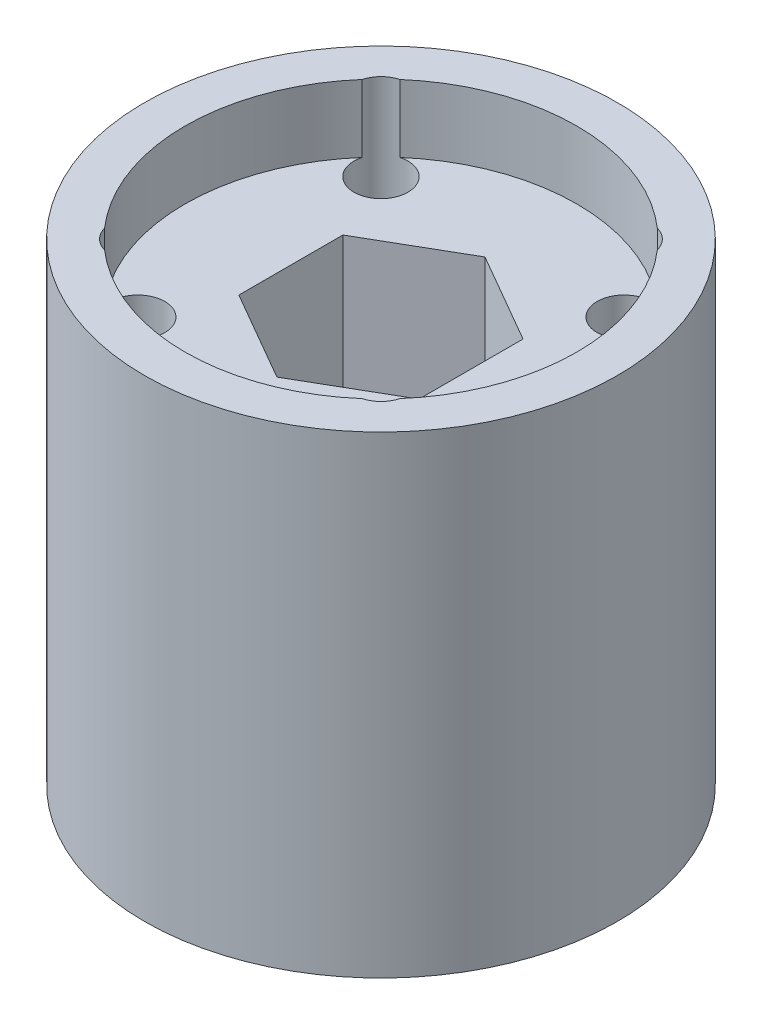
from build123d import *

# Parameters (mm, degrees)
SKETCH1_R           = 17.5
BOSS_EXTRUDE1_DEPTH = 35
CUT_EXTRUDE1_DEPTH  = 15
SKETCH3_R           = 4.1
CUT_EXTRUDE2_DEPTH  = 32.819805153
SKETCH4_R           = 2
CUT_EXTRUDE3_DEPTH  = 43.866070499
SKETCH5_R           = 14.5
CUT_EXTRUDE4_DEPTH  = 5


with BuildPart() as part:
    # Sketch1 → Boss-Extrude1 (new body)
    with BuildSketch(Plane(origin=(0, 0, 0), x_dir=(1, 0, 0), z_dir=(0, 1, 0))):
        with Locations(Location((0, 0, 0), (0, 0, 270))):
            Circle(SKETCH1_R)
    extrude(amount=BOSS_EXTRUDE1_DEPTH)

    # Sketch2 → Cut-Extrude1 (cut)
    with BuildSketch(Plane(origin=(0, 35, 0), x_dir=(1, 0, 0), z_dir=(0, 1, 0))):
        Polygon((0, 7.7), (-6.668395609, 3.85), (-6.668395609, -3.85), (0, -7.7), (6.668395609, -3.85), (6.668395609, 3.85), align=None)
    extrude(amount=-CUT_EXTRUDE1_DEPTH, mode=Mode.SUBTRACT)

    # Sketch3 → Cut-Extrude2 (cut, through all)
    with BuildSketch(Plane(origin=(0, 20, 0), x_dir=(1, 0, 0), z_dir=(0, 1, 0))):
        with Locations(Location((0, 0, 0), (0, 0, 270))):
            Circle(SKETCH3_R)
    extrude(amount=-CUT_EXTRUDE2_DEPTH, mode=Mode.SUBTRACT)

    # Sketch4 → Cut-Extrude3 (cut, through all)
    with BuildSketch(Plane(origin=(0, 35, 0), x_dir=(1, 0, 0), z_dir=(0, 1, 0))):
        with Locations(Location((-9, 9, 0), (0, 0, 270))):
            Circle(SKETCH4_R)
        with Locations(Location((9, 9, 0), (0, 0, 270))):
            Circle(SKETCH4_R)
        with Locations(Location((9, -9, 0), (0, 0, 270))):
            Circle(SKETCH4_R)
        with Locations(Location((-9, -9, 0), (0, 0, 270))):
            Circle(SKETCH4_R)
    extrude(amount=-CUT_EXTRUDE3_DEPTH, mode=Mode.SUBTRACT)

    # Sketch5 → Cut-Extrude4 (cut)
    with BuildSketch(Plane(origin=(0, 35, 0), x_dir=(1, 0, 0), z_dir=(0, 1, 0))):
        Circle(SKETCH5_R)
    extrude(amount=-CUT_EXTRUDE4_DEPTH, mode=Mode.SUBTRACT)


solid = part.part
